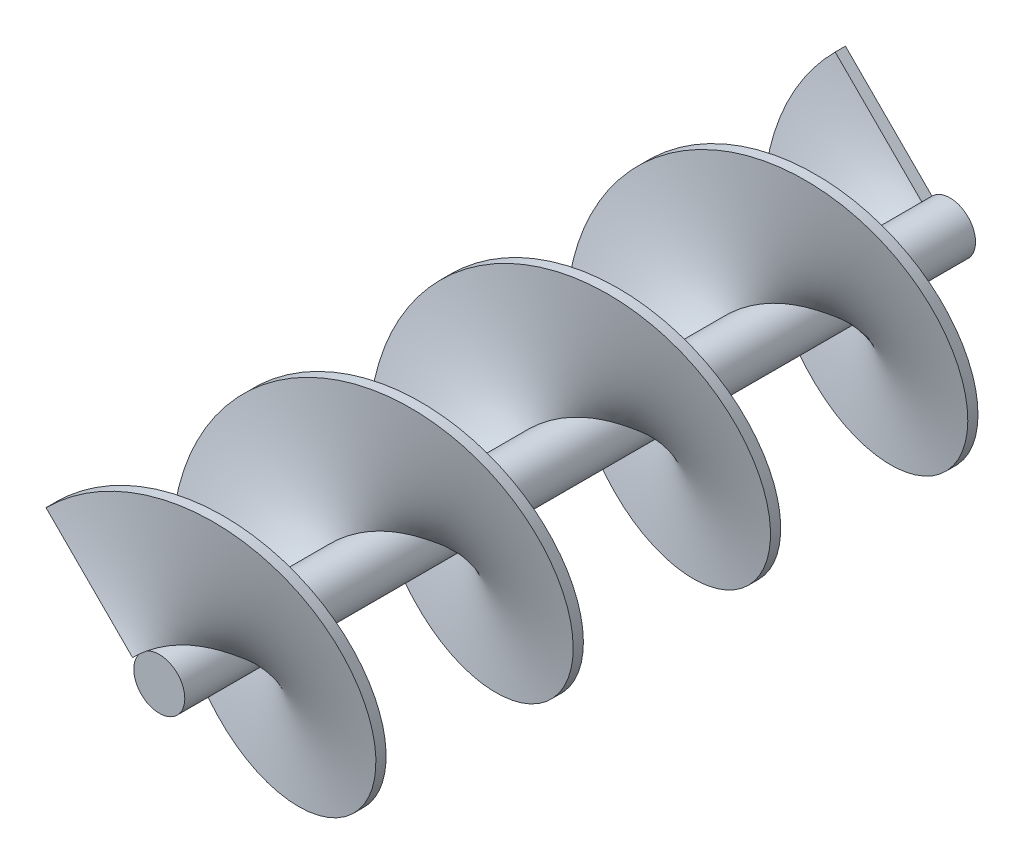
from build123d import *
from build123d.topology import SkipClean

# Parameters (mm, degrees)
SKETCH_1_R          = 5
EXTRUDE_1_DEPTH     = 155
SWEEP_1_PITCH       = 38.675
SWEEP_1_HEIGHT      = 154.7
SWEEP_1_RADIUS      = 5
SWEEP_1_START_ANGLE = 45
SKETCH_4_W          = 2
SKETCH_4_H          = 24
SKETCH_5_R          = 4
CUT_EXTRUDE_1_DEPTH = 8


with BuildPart() as part:
    # 草图1 → 凸台-拉伸1 (new body)
    with BuildSketch(Plane.XY):
        Circle(SKETCH_1_R)
    extrude(amount=EXTRUDE_1_DEPTH)

    # 扫描1: sweep along a helix
    with SkipClean():  # the faces are left unmerged after this step: merging them gives an invalid solid
        with BuildLine() as sweep_1_path:
            add(Helix(SWEEP_1_PITCH, SWEEP_1_HEIGHT, SWEEP_1_RADIUS, center=(0, 0, 155), direction=(0, 0, -1), mode=Mode.PRIVATE).rotate(Axis((0, 0, 155), (0, 0, -1)), SWEEP_1_START_ANGLE))
        # 草图4 → 扫描1 (sweep)
        with BuildSketch(Plane(origin=(-3.535533906, 3.535533906, 0.3), x_dir=(0, 0, 1), z_dir=(-0.7071067811866223, -0.7071067811864729, 0))):
            with Locations((0.7, 12)):
                Rectangle(SKETCH_4_W, SKETCH_4_H)
        sweep(path=sweep_1_path.line, is_frenet=True)

    # 草图5 → 切除-拉伸1 (cut)
    with SkipClean():  # the faces are left unmerged after this step: merging them gives an invalid solid
        with BuildSketch(Plane(origin=(0, 0, 0), x_dir=(-1, 0, 0), z_dir=(0, 0, -1))):
            Circle(SKETCH_5_R)
        extrude(amount=-CUT_EXTRUDE_1_DEPTH, mode=Mode.SUBTRACT)


solid = part.part
